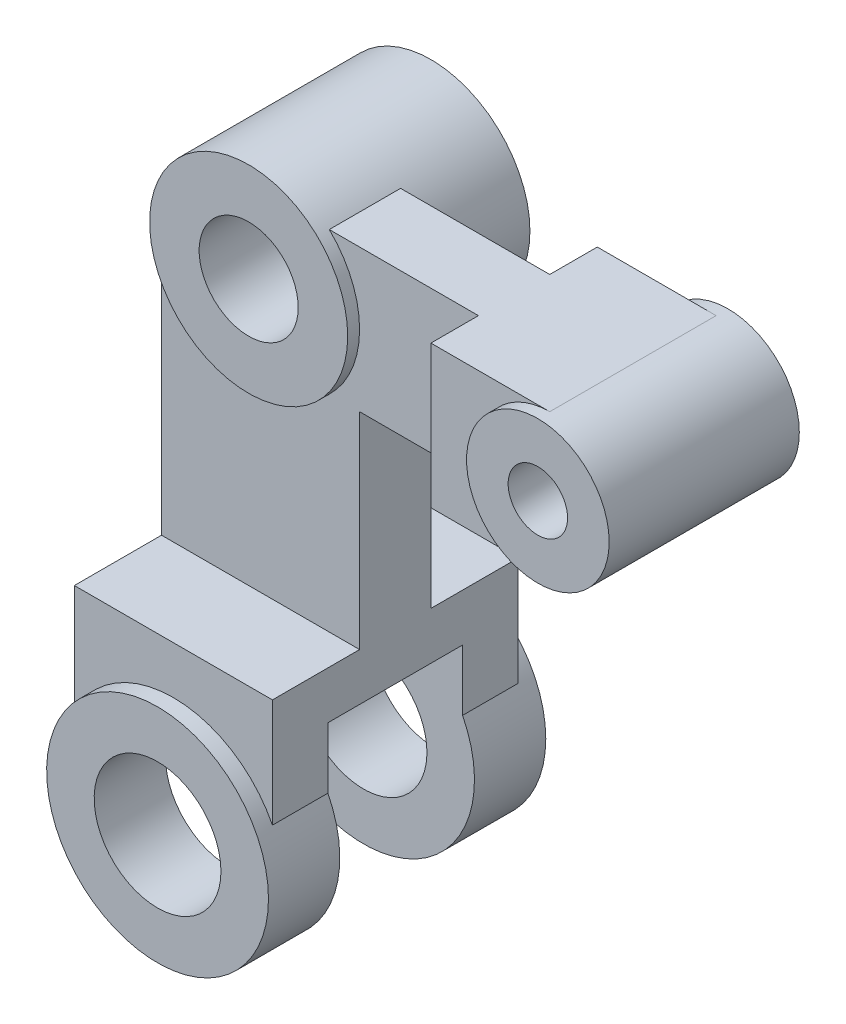
from build123d import *

# Parameters (mm, degrees)
BOSS_EXTRUDE1_DEPTH      = 3
BOSS_EXTRUDE1_DEPTH_BACK = 43
SKETCH1_R                = 12.5
BOSS_EXTRUDE2_DEPTH      = 18
SKETCH2_R                = 16
BOSS_EXTRUDE3_DEPTH      = 35
BOSS_EXTRUDE4_DEPTH      = 31
CUT_EXTRUDE1_DEPTH       = 152.558569537
CUT_EXTRUDE1_DEPTH_BACK  = 152.558569537
SKETCH3_W                = 34
SKETCH3_H                = 83.380174096
SKETCH4_R                = 7.5
BOSS_EXTRUDE5_DEPTH      = 24
BOSS_EXTRUDE6_DEPTH      = 21
BOSS_EXTRUDE7_DEPTH      = 9


with BuildPart() as part:
    # Sketch1 → Boss-Extrude1 (new, two sides: drawn at the far end of the back side and taken through both)
    with BuildSketch(Plane.XY.offset(-BOSS_EXTRUDE1_DEPTH_BACK)):
        with BuildLine():
            ThreePointArc((25, 110), (0, 135), (-25, 110))
            ThreePointArc((-25, 110), (0, 85), (25, 110))
        make_face()
        with Locations((0, 110)):
            Circle(SKETCH1_R, mode=Mode.SUBTRACT)
    extrude(amount=BOSS_EXTRUDE1_DEPTH + BOSS_EXTRUDE1_DEPTH_BACK)

    # Sketch1<3> → Boss-Extrude2 (add)
    with BuildSketch(Plane.XY):
        with BuildLine():
            ThreePointArc((25, 110), (0, 85), (-25, 110))
            Line((-25, 110), (-25, 40))
            Line((-25, 40), (25, 40))
            Line((25, 40), (25, 110))
        make_face()
    extrude(amount=-BOSS_EXTRUDE2_DEPTH)



with BuildPart() as body_2:
    # Sketch2 → Boss-Extrude3 (new, symmetric)
    with BuildSketch(Plane.XY.offset(-9)):
        with BuildLine():
            ThreePointArc((25, 12.609520213), (0, 28), (-25, 12.609520213))
            ThreePointArc((-25, 12.609520213), (-6.480740698, -27.239676944), (28, 0))
            ThreePointArc((28, 0), (27.239676944, 6.480740698), (25, 12.609520213))
        make_face()
        Circle(SKETCH2_R, mode=Mode.SUBTRACT)
    extrude(amount=BOSS_EXTRUDE3_DEPTH, both=True)


with BuildPart() as part_1:
    add(part.part)

    add(body_2.part)  # Boss-Extrude4 merges body 2
    # Sketch2<3> → Boss-Extrude4 (add, symmetric)
    with BuildSketch(Plane.XY.offset(-9)):
        with BuildLine():
            Line((25, 40), (-25, 40))
            Line((-25, 40), (-25, 12.609520213))
            ThreePointArc((-25, 12.609520213), (0, 28), (25, 12.609520213))
            Line((25, 12.609520213), (25, 40))
        make_face()
    extrude(amount=BOSS_EXTRUDE4_DEPTH, both=True)

    # Sketch3 → Cut-Extrude1 (cut, two sides: drawn at the far end of the back side and taken through both)
    with BuildSketch(Plane.ZY.offset(25).offset(-CUT_EXTRUDE1_DEPTH_BACK)):
        with Locations((-9, -13.690087048)):
            Rectangle(SKETCH3_W, SKETCH3_H)
    extrude(amount=CUT_EXTRUDE1_DEPTH + CUT_EXTRUDE1_DEPTH_BACK, mode=Mode.SUBTRACT)



with BuildPart() as body_2_2:
    # Sketch4 → Boss-Extrude5 (new, symmetric)
    with BuildSketch(Plane.XY.offset(-9)):
        with BuildLine():
            ThreePointArc((103, 110), (97.727922061, 122.727922061), (85, 128))
            ThreePointArc((85, 128), (67, 110), (85, 92))
            ThreePointArc((85, 92), (97.727922061, 97.272077939), (103, 110))
        make_face()
        with Locations((85, 110)):
            Circle(SKETCH4_R, mode=Mode.SUBTRACT)
    extrude(amount=BOSS_EXTRUDE5_DEPTH, both=True)

    # Sketch4<3> → Boss-Extrude6 (add, symmetric)
    with BuildSketch(Plane.XY.offset(-9)):
        with BuildLine():
            ThreePointArc((85, 92), (67, 110), (85, 128))
            Line((85, 128), (55, 128))
            Line((55, 128), (55, 92))
            Line((55, 92), (85, 92))
        make_face()
    extrude(amount=BOSS_EXTRUDE6_DEPTH, both=True)


with BuildPart() as part_2:
    add(part_1.part)

    add(body_2_2.part)  # Boss-Extrude7 merges body 2 2
    # Sketch4<4> → Boss-Extrude7 (add, symmetric)
    with BuildSketch(Plane.XY.offset(-9)):
        with BuildLine():
            Line((55, 92), (55, 128))
            Line((55, 128), (17.349351573, 128))
            ThreePointArc((17.349351573, 128), (25, 110), (17.349351573, 92))
            Line((17.349351573, 92), (55, 92))
        make_face()
    extrude(amount=BOSS_EXTRUDE7_DEPTH, both=True)


solid = part_2.part
